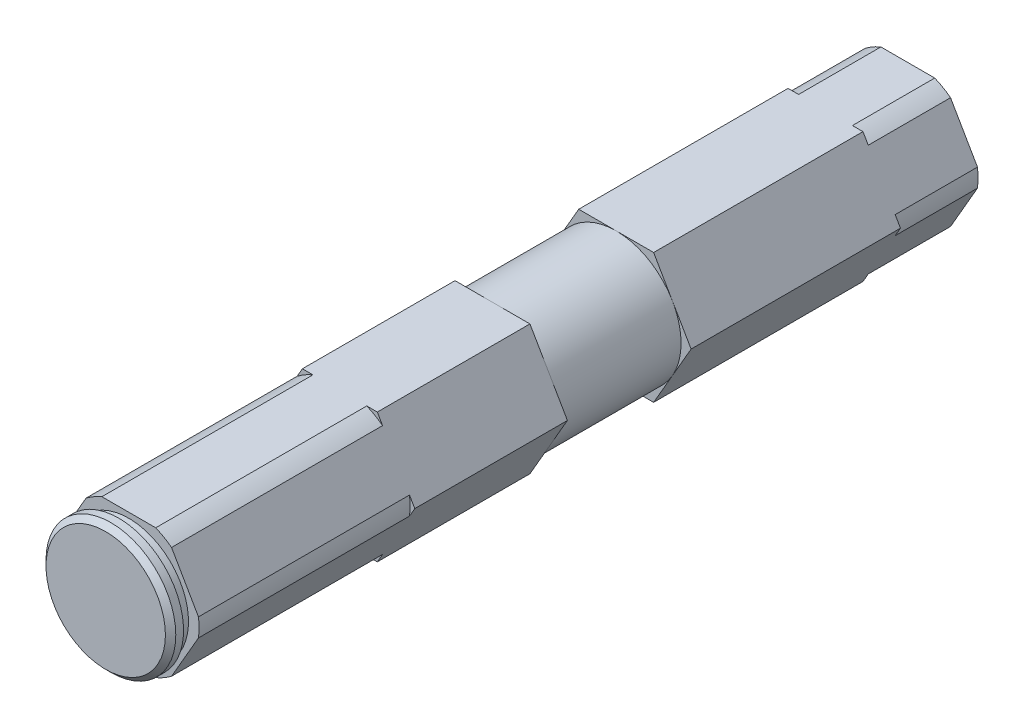
from build123d import *

# Parameters (mm, degrees)
SKETCH2_OUTSIDE_W  = 34.202
SKETCH2_OUTSIDE_H  = 34.202
CUT_EXTRUDE1_DEPTH = 78.047514026
CHAMFER1_SIZE      = 0.508


with BuildPart() as part:
    # Sketch1 → Revolve1 (revolve)
    with BuildSketch(Plane(origin=(0, 0, 0), x_dir=(0, 0, -1), z_dir=(1, 0, 0)), mode=Mode.PRIVATE) as revolve1_sk:
        Polygon((0, 0), (0, 6.35), (1.27, 6.35), (1.27, 5.842), (2.2606, 5.842), (2.2606, 6.875), (22.9108, 6.875), (22.9108, 7.9375), (37.846, 7.9375), (37.846, 6.875), (37.846, 6.35), (49.9491, 6.35), (49.9491, 7.9375), (70.4342, 7.9375), (70.4342, 6.875), (78.486, 6.875), (78.486, 0), align=None)
    revolve(revolve1_sk.sketch.rotate(Axis((0, 0, 0), (0, 0, 1)), 90), axis=Axis((0, 0, 0), (0, 0, 1)))

    # Sketch2 outside → Cut-Extrude1 (cut, through all)
    with BuildSketch(Plane.XY.offset(-2.2606)):
        Rectangle(SKETCH2_OUTSIDE_W, SKETCH2_OUTSIDE_H)
        Polygon((3.666174209, 6.35), (-3.666174209, 6.35), (-7.332348419, 0), (-3.666174209, -6.35), (3.666174209, -6.35), (7.332348419, 0), align=None, mode=Mode.SUBTRACT)
    extrude(amount=-CUT_EXTRUDE1_DEPTH, mode=Mode.SUBTRACT)

    # Chamfer1
    chamfer1_edges = [part.edges().sort_by_distance(p)[0] for p in [
        (6.35, 0, 0),
    ]]
    chamfer(chamfer1_edges, length=CHAMFER1_SIZE)


solid = part.part
